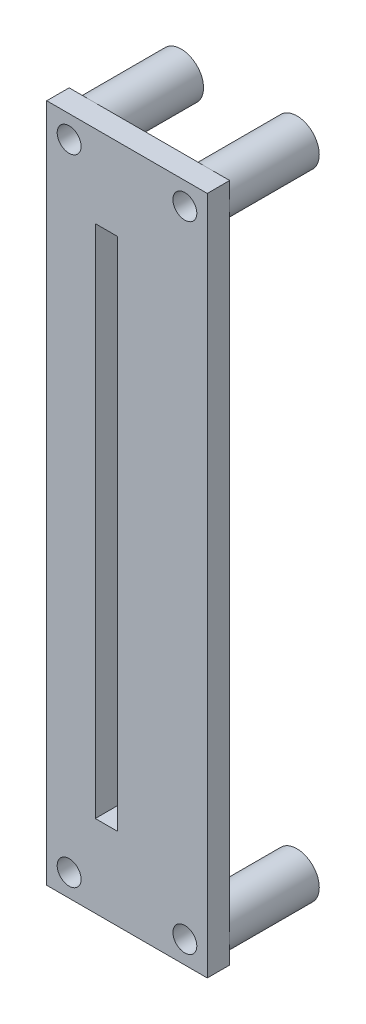
from build123d import *

# Parameters (mm, degrees)
SKETCH1_W           = 21.5
SKETCH1_H           = 91
SKETCH1_R           = 1.6
SKETCH1_W_2         = 3
SKETCH1_H_2         = 69
BOSS_EXTRUDE1_DEPTH = 3
BOSS_EXTRUDE2_START = -12
SKETCH2_R           = 3
SKETCH2_R_2         = 1.6
BOSS_EXTRUDE2_DEPTH = 12


with BuildPart() as part:
    # Sketch1 → Boss-Extrude1 (new body)
    with BuildSketch(Plane.XY):
        with Locations((10.75, 45.5)):
            Rectangle(SKETCH1_W, SKETCH1_H)
        with Locations((3, 88)):
            Circle(SKETCH1_R, mode=Mode.SUBTRACT)
        with Locations((18.5, 88)):
            Circle(SKETCH1_R, mode=Mode.SUBTRACT)
        with Locations((3, 3)):
            Circle(SKETCH1_R, mode=Mode.SUBTRACT)
        with Locations((18.5, 3)):
            Circle(SKETCH1_R, mode=Mode.SUBTRACT)
        with Locations((8, 45.5)):
            Rectangle(SKETCH1_W_2, SKETCH1_H_2, mode=Mode.SUBTRACT)
    extrude(amount=BOSS_EXTRUDE1_DEPTH)

    # Sketch2 → Boss-Extrude2 (add)
    # profile 1 of 4: a face of its own
    with BuildSketch(Plane.XY.offset(BOSS_EXTRUDE2_START)):
        with Locations((3, 3)):
            Circle(SKETCH2_R)
        with Locations((3, 3)):
            Circle(SKETCH2_R_2, mode=Mode.SUBTRACT)
    # profile 2 of 4: a face of its own
    with BuildSketch(Plane.XY.offset(BOSS_EXTRUDE2_START)):
        with Locations((18.5, 3)):
            Circle(SKETCH2_R)
        with Locations((18.5, 3)):
            Circle(SKETCH2_R_2, mode=Mode.SUBTRACT)
    # profile 3 of 4: a face of its own
    with BuildSketch(Plane.XY.offset(BOSS_EXTRUDE2_START)):
        with Locations((18.5, 88)):
            Circle(SKETCH2_R)
        with Locations((18.5, 88)):
            Circle(SKETCH2_R_2, mode=Mode.SUBTRACT)
    # profile 4 of 4: a face of its own
    with BuildSketch(Plane.XY.offset(BOSS_EXTRUDE2_START)):
        with Locations((3, 88)):
            Circle(SKETCH2_R)
        with Locations((3, 88)):
            Circle(SKETCH2_R_2, mode=Mode.SUBTRACT)
    extrude(amount=BOSS_EXTRUDE2_DEPTH)


solid = part.part
